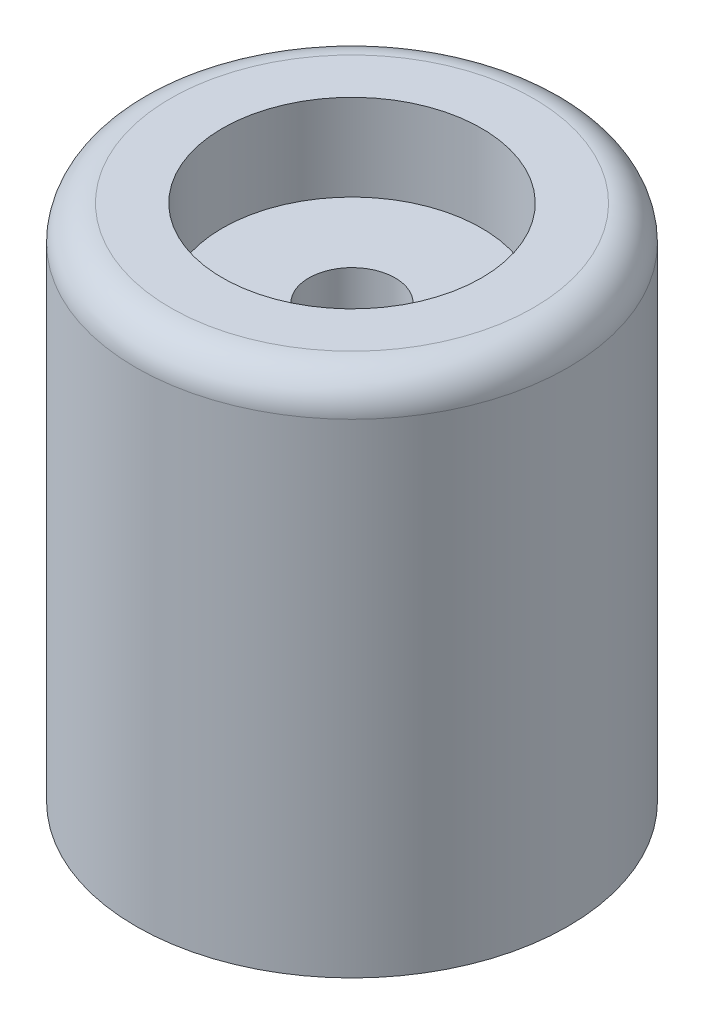
from build123d import *

# Parameters (mm, degrees)
FILLET1_R = 2.54


with BuildPart() as part:
    # Sketch1 → Revolve1 (revolve)
    with BuildSketch(Plane.XY, mode=Mode.PRIVATE) as revolve1_sk:
        Polygon((-3.175, 31.75), (-9.525, 31.75), (-9.525, 38.1), (-15.875, 38.1), (-15.875, 0), (-3.175, 0), align=None)
    revolve(revolve1_sk.sketch.rotate(Axis((0, 0, 0), (0, 1, 0)), 180), axis=Axis((0, 0, 0), (0, 1, 0)))

    # Fillet1
    fillet1_edges = [part.edges().sort_by_distance(p)[0] for p in [
        (-15.875, 38.1, 0),
    ]]
    fillet(fillet1_edges, radius=FILLET1_R)


solid = part.part
